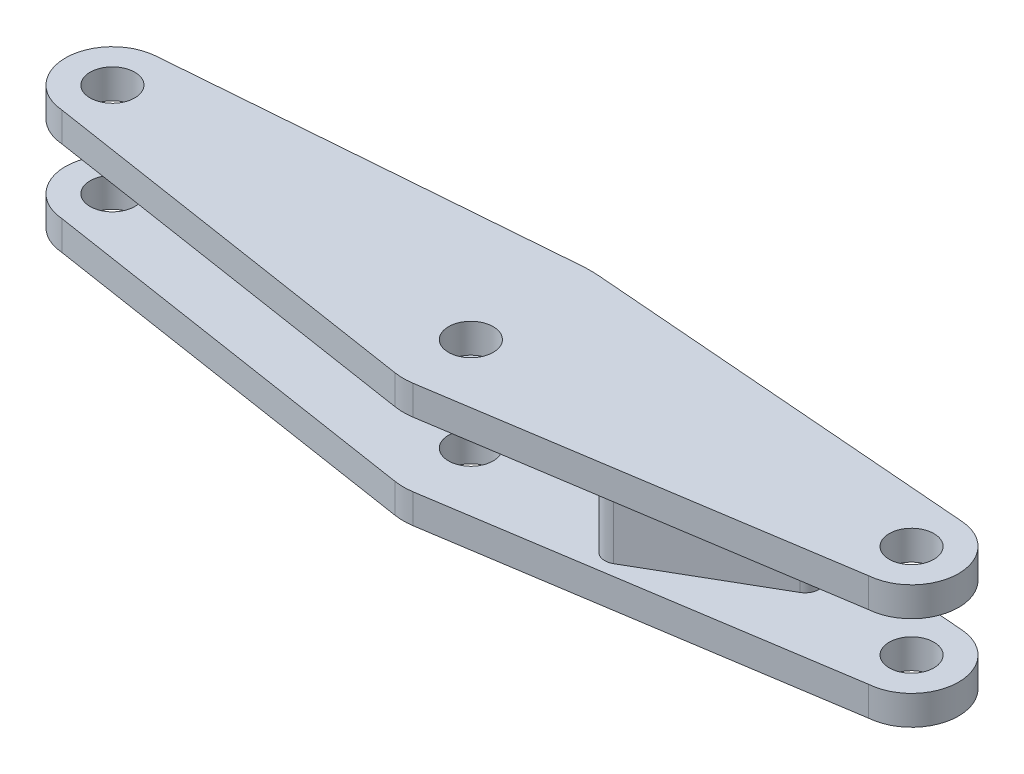
from build123d import *

# Parameters (mm, degrees)
SKETCH1_R                = 0.95
BOSS_EXTRUDE1_DEPTH      = 2.625
SKETCH3_W                = 38
SKETCH3_H                = 2.75
CUT_EXTRUDE1_DEPTH       = 5
BOSS_EXTRUDE3_DEPTH      = 1.375
BOSS_EXTRUDE3_DEPTH_BACK = 2.625


with BuildPart() as part:
    # Sketch1 → Boss-Extrude1 (new, symmetric)
    with BuildSketch(Plane(origin=(0, 0, 0), x_dir=(1, 0, 0), z_dir=(0, 1, 0))):
        with BuildLine():
            Line((-0.393995074, 3.318856737), (-17.15759803, 1.993781046))
            ThreePointArc((-17.15759803, 1.993781046), (-19, 0), (-17.15759803, -1.993781046))
            Line((-17.15759803, -1.993781046), (-0.382476184, -4.590787721))
            ThreePointArc((-0.382476184, -4.590787721), (0, -4.620218562), (0.382476184, -4.590787721))
            Line((0.382476184, -4.590787721), (17.15759803, -1.993781046))
            ThreePointArc((17.15759803, -1.993781046), (19, 0), (17.15759803, 1.993781046))
            Line((17.15759803, 1.993781046), (0.393995074, 3.318856737))
            ThreePointArc((0.393995074, 3.318856737), (0, 3.334404121), (-0.393995074, 3.318856737))
        make_face()
        with Locations(Location((-17, 0, 0), (0, 0, 90))):
            Circle(SKETCH1_R, mode=Mode.SUBTRACT)
        with Locations(Location((17, 0, 0), (0, 0, 90))):
            Circle(SKETCH1_R, mode=Mode.SUBTRACT)
        with Locations(Location((0, -1.75, 0), (0, 0, 90))):
            Circle(SKETCH1_R, mode=Mode.SUBTRACT)
    extrude(amount=BOSS_EXTRUDE1_DEPTH, both=True)

    # Sketch3 → Cut-Extrude1 (cut, symmetric)
    with BuildSketch(Plane.XY):
        Rectangle(SKETCH3_W, SKETCH3_H)
    extrude(amount=CUT_EXTRUDE1_DEPTH, both=True, mode=Mode.SUBTRACT)


with BuildPart() as cut_extrude1_piece_1:
    # of the separate pieces the step leaves, piece 1, a body of its own (cut_extrude1_pieces)
    add(part.part.solids().sort_by_distance((0.393995074, -1.375, -3.318856737))[0])



with BuildPart() as cut_extrude1_piece_2:
    # of the separate pieces the step leaves, piece 2, a body of its own (cut_extrude1_pieces)
    add(part.part.solids().sort_by_distance((0.393995074, 2.625, -3.318856737))[0])


with BuildPart() as cut_extrude1_piece_1_1:
    add(cut_extrude1_piece_1.part)

    add(cut_extrude1_piece_2.part)  # Boss-Extrude3 merges Cut-Extrude1 piece 2
    # Sketch4 → Boss-Extrude3 (add, two sides: drawn at the far end of the back side and taken through both)
    with BuildSketch(Plane(origin=(0, 0, 0), x_dir=(1, 0, 0), z_dir=(0, 1, 0)).offset(-BOSS_EXTRUDE3_DEPTH_BACK)):
        with BuildLine():
            Line((6.699698425, -1.933474209), (11.720961536, 0.969441011))
            ThreePointArc((11.720961536, 0.969441011), (12.540704122, 0.750301575), (12.321564685, -0.069441011))
            Line((12.321564685, -0.069441011), (7.300301575, -2.972356232))
            ThreePointArc((7.300301575, -2.972356232), (6.480558989, -2.753216795), (6.699698425, -1.933474209))
        make_face()
    extrude(amount=BOSS_EXTRUDE3_DEPTH + BOSS_EXTRUDE3_DEPTH_BACK)


solid = cut_extrude1_piece_1_1.part
